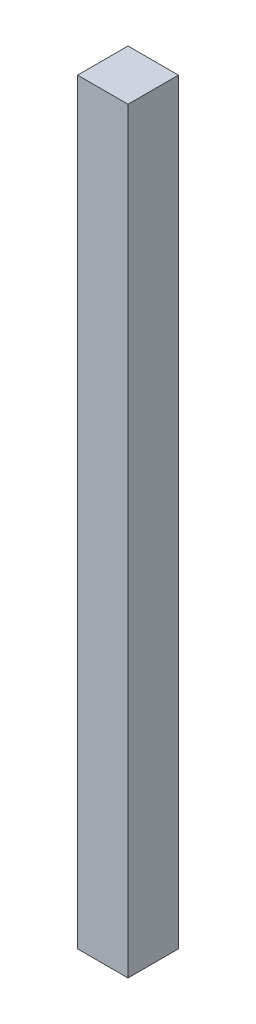
from build123d import *

# Parameters (mm, degrees)
SKETCH1_W           = 20
SKETCH1_H           = 20
BOSS_EXTRUDE1_DEPTH = 300


with BuildPart() as part:
    # Sketch1 → Boss-Extrude1 (new body)
    with BuildSketch(Plane(origin=(0, 0, 0), x_dir=(1, 0, 0), z_dir=(0, 1, 0))):
        with Locations((10, -10)):
            Rectangle(SKETCH1_W, SKETCH1_H)
    extrude(amount=BOSS_EXTRUDE1_DEPTH)


solid = part.part
